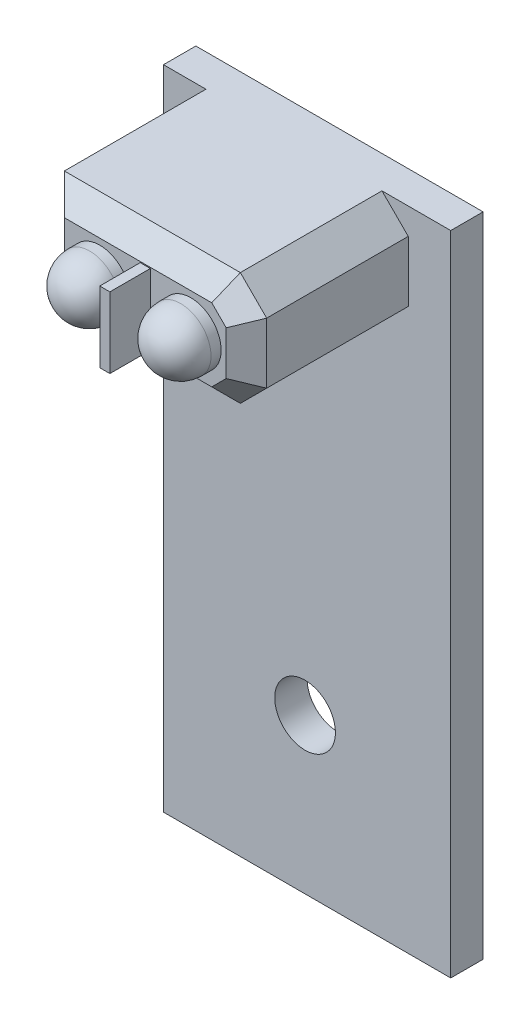
from build123d import *

# Parameters (mm, degrees)
CROQUIS1_W              = 14.2
CROQUIS1_H              = 32
SALIENTE_EXTRUIR1_DEPTH = 1.6
CROQUIS2_R              = 1.5
CORTAR_EXTRUIR1_DEPTH   = 18.57754249
SALIENTE_EXTRUIR2_DEPTH = 10
CROQUIS4_R              = 1.5
CROQUIS4_W              = 0.5
CROQUIS4_H              = 3.5
CORTAR_EXTRUIR2_DEPTH   = 2
CHAFL_N1_SIZE           = 1
REDONDEO1_R             = 1.5
CROQUIS5_W              = 7
CROQUIS5_H              = 7
SALIENTE_EXTRUIR3_DEPTH = 5


with BuildPart() as part:
    # Croquis1 → Saliente-Extruir1 (new body)
    with BuildSketch(Plane.XY):
        Rectangle(CROQUIS1_W, CROQUIS1_H)
    extrude(amount=SALIENTE_EXTRUIR1_DEPTH)

    # Croquis2 → Cortar-Extruir1 (cut, through all)
    with BuildSketch(Plane.XY.offset(1.6)):
        with Locations((-0.1, -8.35)):
            Circle(CROQUIS2_R)
    extrude(amount=-CORTAR_EXTRUIR1_DEPTH, mode=Mode.SUBTRACT)

    # Croquis3 → Saliente-Extruir2 (add)
    with BuildSketch(Plane.XY.offset(1.6)):
        Polygon((-5, 16), (3.7, 16), (5, 14.7), (5, 11.7), (3.7, 10.4), (-5, 10.4), align=None)
    extrude(amount=SALIENTE_EXTRUIR2_DEPTH)

    # Croquis4 → Cortar-Extruir2 (cut)
    with BuildSketch(Plane.XY.offset(11.6)):
        Polygon((-5, 10.4), (3.7, 10.4), (5, 11.7), (5, 14.7), (3.7, 16), (-5, 16), align=None)
        with Locations((-2.25, 13.2)):
            Circle(CROQUIS4_R, mode=Mode.SUBTRACT)
        with Locations((2.25, 13.2)):
            Circle(CROQUIS4_R, mode=Mode.SUBTRACT)
        with Locations((0, 13.2)):
            Rectangle(CROQUIS4_W, CROQUIS4_H, mode=Mode.SUBTRACT)
    extrude(amount=-CORTAR_EXTRUIR2_DEPTH, mode=Mode.SUBTRACT)

    # Chaflán1
    chafl_n1_edges = [part.edges().sort_by_distance(p)[0] for p in [
        (4.35, 15.35, 9.6),
        (5, 13.2, 9.6),
        (4.35, 11.05, 9.6),
        (-0.65, 10.4, 9.6),
        (-5, 13.2, 9.6),
        (-0.65, 16, 9.6),
    ]]
    chamfer(chafl_n1_edges, length=CHAFL_N1_SIZE)

    # Redondeo1
    redondeo1_edges = [part.edges().sort_by_distance(p)[0] for p in [
        (-3.75, 13.2, 11.6),
        (0.75, 13.2, 11.6),
    ]]
    fillet(redondeo1_edges, radius=REDONDEO1_R)

    # Croquis5 → Saliente-Extruir3 (add)
    with BuildSketch(Plane(origin=(0, 0, 0), x_dir=(-1, 0, 0), z_dir=(0, 0, -1))):
        with Locations((3.1, 0.5)):
            Rectangle(CROQUIS5_W, CROQUIS5_H)
    extrude(amount=SALIENTE_EXTRUIR3_DEPTH)


solid = part.part
